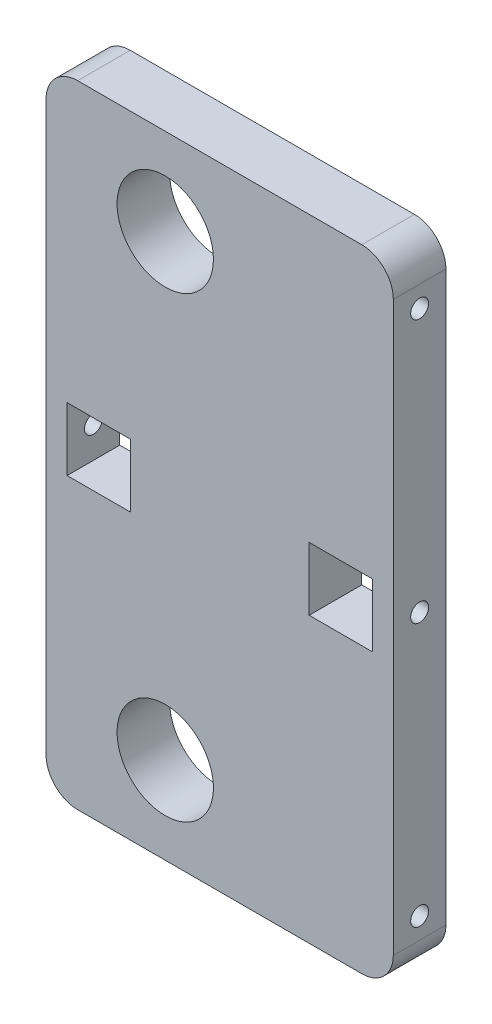
from build123d import *

# Parameters (mm, degrees)
SKETCH1_W           = 33
SKETCH1_H           = 60
SKETCH1_R           = 4.58
SKETCH1_W_2         = 6
SKETCH1_H_2         = 6
BOSS_EXTRUDE1_DEPTH = 5
SKETCH2_R           = 0.85
CUT_EXTRUDE1_DEPTH  = 3
CUT_EXTRUDE2_START  = -3
SKETCH3_R           = 0.85
CUT_EXTRUDE2_DEPTH  = 3
FILLET1_R           = 3


with BuildPart() as part:
    # Sketch1 → Boss-Extrude1 (new body)
    with BuildSketch(Plane.XY):
        Rectangle(SKETCH1_W, SKETCH1_H)
        with Locations((-5.175, 21.75)):
            Circle(SKETCH1_R, mode=Mode.SUBTRACT)
        with Locations(Location((-5.175, -21.75, 0), (0, 0, 180))):
            Circle(SKETCH1_R, mode=Mode.SUBTRACT)
        with Locations((11.5, 0)):
            Rectangle(SKETCH1_W_2, SKETCH1_H_2, mode=Mode.SUBTRACT)
        with Locations((-11.5, 0)):
            Rectangle(SKETCH1_W_2, SKETCH1_H_2, mode=Mode.SUBTRACT)
    extrude(amount=BOSS_EXTRUDE1_DEPTH)

    # Sketch2 → Cut-Extrude1 (cut)
    with BuildSketch(Plane(origin=(16.5, 0, 0), x_dir=(0, 0, -1), z_dir=(1, 0, 0))):
        with Locations((-2.5, 0)):
            Circle(SKETCH2_R)
        with Locations((-2.5, -25)):
            Circle(SKETCH2_R)
        with Locations(Location((-2.5, 25, 0), (0, 0, 180))):
            Circle(SKETCH2_R)
    extrude(amount=-CUT_EXTRUDE1_DEPTH, mode=Mode.SUBTRACT)

    # Sketch3 → Cut-Extrude2 (cut)
    with BuildSketch(Plane.ZY.offset(16.5).offset(CUT_EXTRUDE2_START)):
        with Locations(Location((2.5, 0, 0), (0, 0, 180))):
            Circle(SKETCH3_R)
    extrude(amount=CUT_EXTRUDE2_DEPTH, mode=Mode.SUBTRACT)

    # Fillet1
    fillet1_edges = [part.edges().sort_by_distance(p)[0] for p in [
        (16.5, -30, 2.5),
        (-16.5, -30, 2.5),
        (-16.5, 30, 2.5),
        (16.5, 30, 2.5),
    ]]
    fillet(fillet1_edges, radius=FILLET1_R)


solid = part.part
